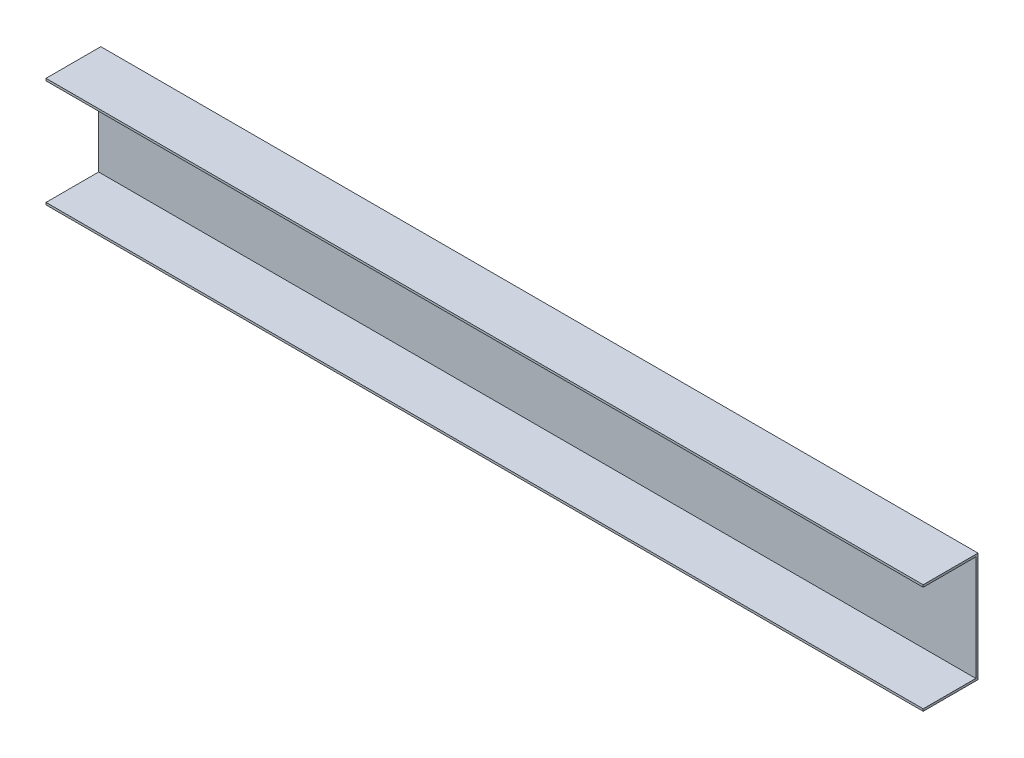
from build123d import *

# Parameters (mm, degrees)
EXTRUIR_L_MINA1_DEPTH = 800


with BuildPart() as part:
    # Croquis2 → Extruir-Lámina1 (new body)
    with BuildSketch(Plane(origin=(0, 0, 0), x_dir=(0, 0, -1), z_dir=(1, 0, 0))):
        Polygon((-50, -50), (0, -50), (0, 50), (-50, 50), (-50, 48), (-2, 48), (-2, -48), (-50, -48), align=None)
    extrude(amount=EXTRUIR_L_MINA1_DEPTH)


solid = part.part
